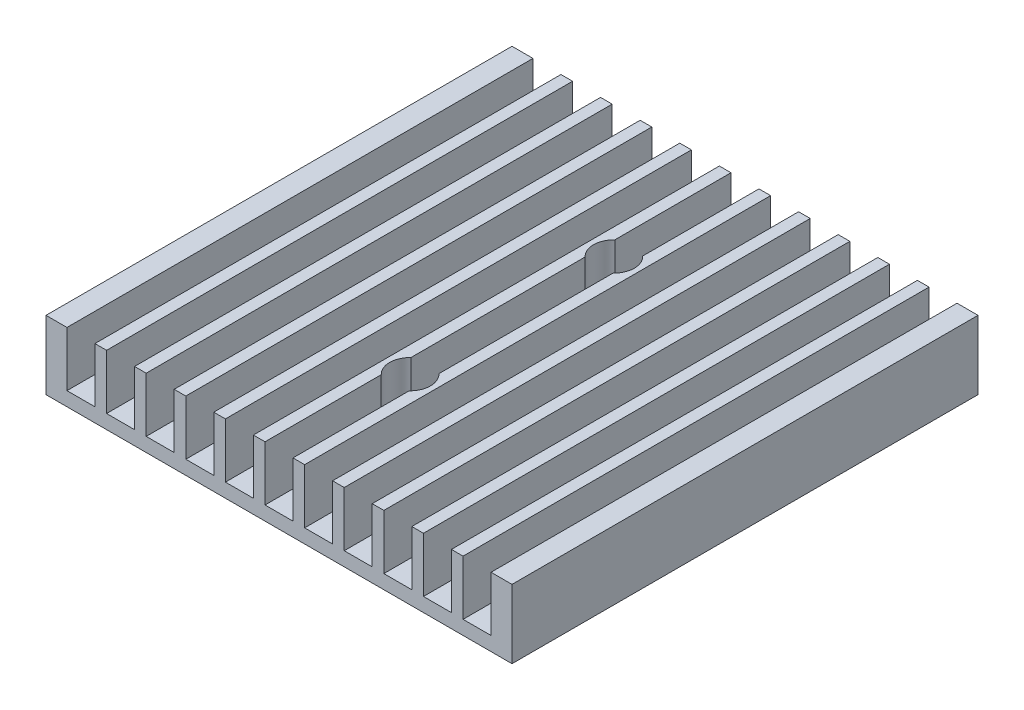
from build123d import *

# Parameters (mm, degrees)
SKETCH1_W           = 101.6
SKETCH1_H           = 101.6
BOSS_EXTRUDE1_DEPTH = 14.986
SKETCH2_W           = 6.096
SKETCH2_H           = 11.938
CUT_EXTRUDE1_DEPTH  = 115.576525502
SKETCH3_R           = 1.651
CUT_EXTRUDE2_DEPTH  = 74.38842004
CUT_EXTRUDE3_START  = -3.048
SKETCH3_3_R         = 4.445
SKETCH3_3_R_2       = 1.651
CUT_EXTRUDE3_DEPTH  = 71.34042004


with BuildPart() as part:
    # Sketch1 → Boss-Extrude1 (new body)
    with BuildSketch(Plane(origin=(0, 0, 0), x_dir=(1, 0, 0), z_dir=(0, 1, 0))):
        Rectangle(SKETCH1_W, SKETCH1_H)
    extrude(amount=BOSS_EXTRUDE1_DEPTH)

    # Sketch2 → Cut-Extrude1 (cut, through all)
    with BuildSketch(Plane.XY.offset(50.8)):
        with Locations((43.18, 9.017)):
            Rectangle(SKETCH2_W, SKETCH2_H)
        with Locations((34.544, 9.017)):
            Rectangle(SKETCH2_W, SKETCH2_H)
        with Locations((25.908, 9.017)):
            Rectangle(SKETCH2_W, SKETCH2_H)
        with Locations((17.272, 9.017)):
            Rectangle(SKETCH2_W, SKETCH2_H)
        with Locations((8.636, 9.017)):
            Rectangle(SKETCH2_W, SKETCH2_H)
        with Locations((0, 9.017)):
            Rectangle(SKETCH2_W, SKETCH2_H)
        with Locations((-8.636, 9.017)):
            Rectangle(SKETCH2_W, SKETCH2_H)
        with Locations((-17.272, 9.017)):
            Rectangle(SKETCH2_W, SKETCH2_H)
        with Locations((-25.908, 9.017)):
            Rectangle(SKETCH2_W, SKETCH2_H)
        with Locations((-34.544, 9.017)):
            Rectangle(SKETCH2_W, SKETCH2_H)
        with Locations((-43.18, 9.017)):
            Rectangle(SKETCH2_W, SKETCH2_H)
    extrude(amount=-CUT_EXTRUDE1_DEPTH, mode=Mode.SUBTRACT)

    # Sketch3 → Cut-Extrude2 (cut, through all)
    with BuildSketch(Plane.XZ):
        with Locations(Location((0, 22.225, 0), (0, 0, 270))):
            Circle(SKETCH3_R)
        with Locations(Location((0, -22.225, 0), (0, 0, 270))):
            Circle(SKETCH3_R)
    extrude(amount=-CUT_EXTRUDE2_DEPTH, mode=Mode.SUBTRACT)

    # Sketch3<3> → Cut-Extrude3 (cut, through all)
    # profile 1 of 2: a face of its own
    with BuildSketch(Plane.XZ.offset(CUT_EXTRUDE3_START)):
        with Locations((0, 22.225)):
            Circle(SKETCH3_3_R)
        with Locations(Location((0, 22.225, 0), (0, 0, 270))):
            Circle(SKETCH3_3_R_2, mode=Mode.SUBTRACT)
    # profile 2 of 2: a face of its own
    with BuildSketch(Plane.XZ.offset(CUT_EXTRUDE3_START)):
        with Locations((0, -22.225)):
            Circle(SKETCH3_3_R)
        with Locations(Location((0, -22.225, 0), (0, 0, 270))):
            Circle(SKETCH3_3_R_2, mode=Mode.SUBTRACT)
    extrude(amount=-CUT_EXTRUDE3_DEPTH, mode=Mode.SUBTRACT)


solid = part.part
